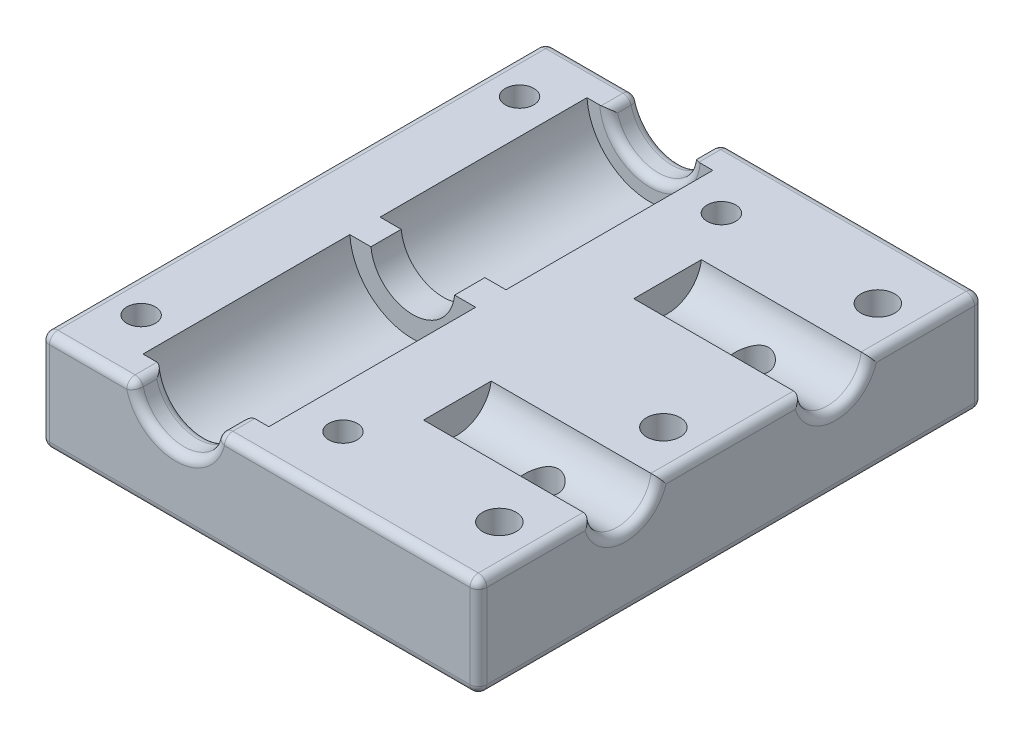
from build123d import *

# Parameters (mm, degrees)
SKETCH1_W           = 32
SKETCH1_H           = 30.5
SKETCH1_R           = 7.5
BOSS_EXTRUDE1_DEPTH = 60
SKETCH9_R           = 7.5
BOSS_EXTRUDE3_DEPTH = 1.8
BOSS_EXTRUDE4_START = -3.6
SKETCH10_R          = 7.5
SKETCH10_R_2        = 5
BOSS_EXTRUDE4_DEPTH = 3.6
SKETCH2_R           = 3
CUT_EXTRUDE2_DEPTH  = 8
SKETCH4_R           = 4.05
BOSS_EXTRUDE2_DEPTH = 20
SKETCH6_W           = 52
SKETCH6_H           = 1
CUT_EXTRUDE4_DEPTH  = 73.249567473
SKETCH7_R           = 1.7
CUT_EXTRUDE5_DEPTH  = 71.992957397
SKETCH8_R           = 2
CUT_EXTRUDE6_DEPTH  = 71.992957397
SKETCH11_R          = 2
CUT_EXTRUDE7_DEPTH  = 71.992957397
SKETCH12_R          = 5
CUT_EXTRUDE8_DEPTH  = 72.079181268
FILLET1_R           = 1


with BuildPart() as part:
    # Sketch1 → Boss-Extrude1 (new body)
    with BuildSketch(Plane.XY):
        with Locations((0, 2.75)):
            Rectangle(SKETCH1_W, SKETCH1_H)
        Circle(SKETCH1_R, mode=Mode.SUBTRACT)
    extrude(amount=BOSS_EXTRUDE1_DEPTH)

    # Sketch9 → Boss-Extrude3 (add, symmetric)
    with BuildSketch(Plane.XY.offset(30)):
        Circle(SKETCH9_R)
    extrude(amount=BOSS_EXTRUDE3_DEPTH, both=True)

    # Sketch10 → Boss-Extrude4 (add)
    with BuildSketch(Plane.XY.offset(60).offset(BOSS_EXTRUDE4_START)):
        Circle(SKETCH10_R)
        Circle(SKETCH10_R_2, mode=Mode.SUBTRACT)
    boss_extrude4 = extrude(amount=BOSS_EXTRUDE4_DEPTH)

    # Mirror1: Boss-Extrude4 across plane
    add(boss_extrude4.mirror(Plane.XY.offset(30)))

    # Sketch2 → Cut-Extrude2 (cut)
    with BuildSketch(Plane(origin=(0, 18, 0), x_dir=(1, 0, 0), z_dir=(0, 1, 0))):
        with Locations(Location((0, -17.5, 0), (0, 0, 180))):
            Circle(SKETCH2_R)
        with Locations(Location((0, -42.5, 0), (0, 0, 180))):
            Circle(SKETCH2_R)
    extrude(amount=-CUT_EXTRUDE2_DEPTH, mode=Mode.SUBTRACT)

    # Sketch4 → Boss-Extrude2 (add)
    with BuildSketch(Plane(origin=(16, 0, 0), x_dir=(0, 0, -1), z_dir=(1, 0, 0))):
        Polygon((-60, -6), (-60, 6), (0, 6), (0, -6), (0, -12.5), (-60, -12.5), align=None)
        with Locations((-42.5, 0)):
            Circle(SKETCH4_R, mode=Mode.SUBTRACT)
        with Locations((-17.5, 0)):
            Circle(SKETCH4_R, mode=Mode.SUBTRACT)
    extrude(amount=BOSS_EXTRUDE2_DEPTH)

    # Sketch6 → Cut-Extrude4 (cut, through all)
    with BuildSketch(Plane.XY.offset(60)):
        with Locations((10, 0)):
            Rectangle(SKETCH6_W, SKETCH6_H)
    extrude(amount=-CUT_EXTRUDE4_DEPTH, mode=Mode.SUBTRACT)


with BuildPart() as cut_extrude4_kept_piece:
    # of the separate pieces the step leaves, the one the design keeps (cut_extrude4_pieces_kept)
    add(part.part.solids().sort_by_distance((-16, -12.5, 0))[0])

    # Sketch7 → Cut-Extrude5 (cut, through all)
    with BuildSketch(Plane(origin=(0, -0.5, 0), x_dir=(1, 0, 0), z_dir=(0, 1, 0))):
        with Locations(Location((-11.6, -7.5, 0), (0, 0, 270))):
            Circle(SKETCH7_R)
        with Locations(Location((-11.6, -52.5, 0), (0, 0, 270))):
            Circle(SKETCH7_R)
        with Locations(Location((12.4, -52.5, 0), (0, 0, 270))):
            Circle(SKETCH7_R)
        with Locations(Location((12.4, -7.5, 0), (0, 0, 270))):
            Circle(SKETCH7_R)
    extrude(amount=-CUT_EXTRUDE5_DEPTH, mode=Mode.SUBTRACT)

    # Sketch8 → Cut-Extrude6 (cut, through all)
    with BuildSketch(Plane(origin=(0, -0.5, 0), x_dir=(1, 0, 0), z_dir=(0, 1, 0))):
        with Locations(Location((31, -7.5, 0), (0, 0, 270))):
            Circle(SKETCH8_R)
        with Locations(Location((31, -33, 0), (0, 0, 270))):
            Circle(SKETCH8_R)
        with Locations(Location((31, -52.5, 0), (0, 0, 270))):
            Circle(SKETCH8_R)
    extrude(amount=-CUT_EXTRUDE6_DEPTH, mode=Mode.SUBTRACT)

    # Sketch11 → Cut-Extrude7 (cut, through all)
    with BuildSketch(Plane.XZ.offset(12.5)):
        with Locations(Location((26, 17.5, 0), (0, 0, 270))):
            Circle(SKETCH11_R)
        with Locations(Location((26, 42.5, 0), (0, 0, 270))):
            Circle(SKETCH11_R)
    extrude(amount=-CUT_EXTRUDE7_DEPTH, mode=Mode.SUBTRACT)

    # Sketch12 → Cut-Extrude8 (cut, through all)
    with BuildSketch(Plane.XY.offset(60)):
        Circle(SKETCH12_R)
    extrude(amount=-CUT_EXTRUDE8_DEPTH, mode=Mode.SUBTRACT)

    # Fillet1
    fillet1_edges = [cut_extrude4_kept_piece.edges().sort_by_distance(p)[0] for p in [
        (0, -5, 60),
        (-16, -6.5, 0),
        (-16, -6.5, 60),
        (20.487468593, -0.5, 60),
        (-10.487468593, -0.5, 60),
        (-4.974937186, -0.5, 58.2),
        (-10.487468593, -0.5, 0),
        (20.487468593, -0.5, 0),
        (36, -0.5, 6.740491354),
        (36, -0.5, 30),
        (36, -0.5, 53.259508646),
        (4.974937186, -0.5, 58.2),
        (-4.974937186, -0.5, 1.8),
        (4.974937186, -0.5, 1.8),
        (-16, -0.5, 30),
        (36, -6.5, 0),
        (36, -12.5, 30),
        (10, -12.5, 0),
        (36, -4.05, 17.5),
        (36, -4.05, 42.5),
        (36, -6.5, 60),
        (-16, -12.5, 30),
        (0, -5, 3.6),
        (0, -5, 0),
        (10, -12.5, 60),
        (0, -5, 56.4),
    ]]
    fillet(fillet1_edges, radius=FILLET1_R)


solid = cut_extrude4_kept_piece.part
